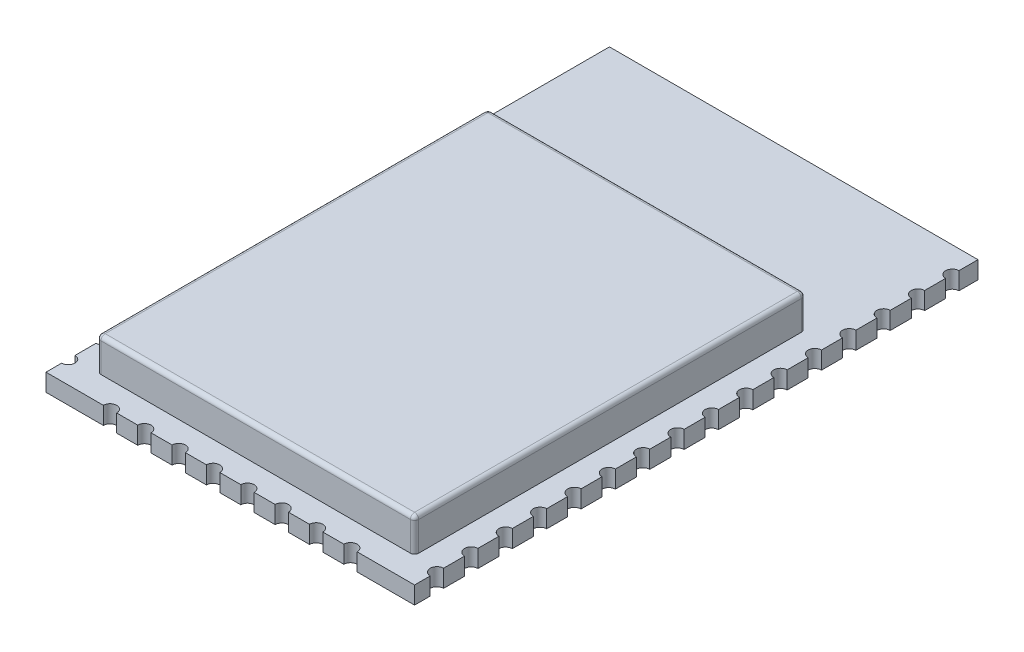
from build123d import *

# Parameters (mm, degrees)
ESQUISSE1_W             = 22.098
ESQUISSE1_H             = 33.782
BOSS_EXTRU_1_DEPTH      = 1.048
ESQUISSE2_W             = 19.05
ESQUISSE2_H             = 23.442994478
BOSS_EXTRU_2_DEPTH      = 2
ENL_V_MAT_EXTRU_1_DEPTH = 2
CONG_1_R                = 0.25


with BuildPart() as part:
    # Esquisse1 → Boss.-Extru.1 (new body)
    with BuildSketch(Plane(origin=(0, 0, 0), x_dir=(1, 0, 0), z_dir=(0, 1, 0))):
        with Locations((11.049, 16.891)):
            Rectangle(ESQUISSE1_W, ESQUISSE1_H)
    extrude(amount=BOSS_EXTRU_1_DEPTH)

    # Esquisse2 → Boss.-Extru.2 (add)
    with BuildSketch(Plane(origin=(0, 1.048, 0), x_dir=(1, 0, 0), z_dir=(0, 1, 0))):
        with Locations((11.049, 13.245497239)):
            Rectangle(ESQUISSE2_W, ESQUISSE2_H)
    extrude(amount=BOSS_EXTRU_2_DEPTH)

    # Esquisse3 → Enlèv. mat.-Extru.1 (cut)
    with BuildSketch(Plane(origin=(0, 1.048, 0), x_dir=(1, 0, 0), z_dir=(0, 1, 0))):
        with BuildLine():
            Line((0, 26.4604), (0, 25.6604))
            ThreePointArc((0, 25.6604), (0.4, 26.0604), (0, 26.4604))
        make_face()
        with BuildLine():
            Line((22.098, 26.4604), (22.098, 25.6604))
            ThreePointArc((22.098, 25.6604), (21.698, 26.0604), (22.098, 26.4604))
        make_face()
        with BuildLine():
            Line((22.098, 24.4004), (22.098, 23.6004))
            ThreePointArc((22.098, 23.6004), (21.698, 24.0004), (22.098, 24.4004))
        make_face()
        with BuildLine():
            Line((0, 24.4004), (0, 23.6004))
            ThreePointArc((0, 23.6004), (0.4, 24.0004), (0, 24.4004))
        make_face()
        with BuildLine():
            Line((22.098, 22.3404), (22.098, 21.5404))
            ThreePointArc((22.098, 21.5404), (21.698, 21.9404), (22.098, 22.3404))
        make_face()
        with BuildLine():
            Line((0, 22.3404), (0, 21.5404))
            ThreePointArc((0, 21.5404), (0.4, 21.9404), (0, 22.3404))
        make_face()
        with BuildLine():
            Line((22.098, 20.2804), (22.098, 19.4804))
            ThreePointArc((22.098, 19.4804), (21.698, 19.8804), (22.098, 20.2804))
        make_face()
        with BuildLine():
            Line((0, 20.2804), (0, 19.4804))
            ThreePointArc((0, 19.4804), (0.4, 19.8804), (0, 20.2804))
        make_face()
        with BuildLine():
            Line((22.098, 18.2204), (22.098, 17.4204))
            ThreePointArc((22.098, 17.4204), (21.698, 17.8204), (22.098, 18.2204))
        make_face()
        with BuildLine():
            Line((0, 18.2204), (0, 17.4204))
            ThreePointArc((0, 17.4204), (0.4, 17.8204), (0, 18.2204))
        make_face()
        with BuildLine():
            Line((22.098, 16.1604), (22.098, 15.3604))
            ThreePointArc((22.098, 15.3604), (21.698, 15.7604), (22.098, 16.1604))
        make_face()
        with BuildLine():
            Line((0, 16.1604), (0, 15.3604))
            ThreePointArc((0, 15.3604), (0.4, 15.7604), (0, 16.1604))
        make_face()
        with BuildLine():
            Line((22.098, 14.1004), (22.098, 13.3004))
            ThreePointArc((22.098, 13.3004), (21.698, 13.7004), (22.098, 14.1004))
        make_face()
        with BuildLine():
            Line((0, 14.1004), (0, 13.3004))
            ThreePointArc((0, 13.3004), (0.4, 13.7004), (0, 14.1004))
        make_face()
        with BuildLine():
            Line((22.098, 12.0404), (22.098, 11.2404))
            ThreePointArc((22.098, 11.2404), (21.698, 11.6404), (22.098, 12.0404))
        make_face()
        with BuildLine():
            Line((0, 12.0404), (0, 11.2404))
            ThreePointArc((0, 11.2404), (0.4, 11.6404), (0, 12.0404))
        make_face()
        with BuildLine():
            Line((22.098, 9.9804), (22.098, 9.1804))
            ThreePointArc((22.098, 9.1804), (21.698, 9.5804), (22.098, 9.9804))
        make_face()
        with BuildLine():
            Line((0, 9.9804), (0, 9.1804))
            ThreePointArc((0, 9.1804), (0.4, 9.5804), (0, 9.9804))
        make_face()
        with BuildLine():
            Line((22.098, 7.9204), (22.098, 7.1204))
            ThreePointArc((22.098, 7.1204), (21.698, 7.5204), (22.098, 7.9204))
        make_face()
        with BuildLine():
            Line((0, 7.9204), (0, 7.1204))
            ThreePointArc((0, 7.1204), (0.4, 7.5204), (0, 7.9204))
        make_face()
        with BuildLine():
            Line((22.098, 5.8604), (22.098, 5.0604))
            ThreePointArc((22.098, 5.0604), (21.698, 5.4604), (22.098, 5.8604))
        make_face()
        with BuildLine():
            Line((0, 5.8604), (0, 5.0604))
            ThreePointArc((0, 5.0604), (0.4, 5.4604), (0, 5.8604))
        make_face()
        with BuildLine():
            Line((22.098, 3.8004), (22.098, 3.0004))
            ThreePointArc((22.098, 3.0004), (21.698, 3.4004), (22.098, 3.8004))
        make_face()
        with BuildLine():
            Line((0, 3.8004), (0, 3.0004))
            ThreePointArc((0, 3.0004), (0.4, 3.4004), (0, 3.8004))
        make_face()
        with BuildLine():
            Line((22.098, 1.7404), (22.098, 0.9404))
            ThreePointArc((22.098, 0.9404), (21.698, 1.3404), (22.098, 1.7404))
        make_face()
        with BuildLine():
            Line((0, 1.7404), (0, 0.9404))
            ThreePointArc((0, 0.9404), (0.4, 1.3404), (0, 1.7404))
        make_face()
        with BuildLine():
            Line((22.098, 28.5204), (22.098, 27.7204))
            ThreePointArc((22.098, 27.7204), (21.698, 28.1204), (22.098, 28.5204))
        make_face()
        with BuildLine():
            Line((22.098, 30.5804), (22.098, 29.7804))
            ThreePointArc((22.098, 29.7804), (21.698, 30.1804), (22.098, 30.5804))
        make_face()
        with BuildLine():
            Line((22.098, 32.6404), (22.098, 31.8404))
            ThreePointArc((22.098, 31.8404), (21.698, 32.2404), (22.098, 32.6404))
        make_face()
        with BuildLine():
            Line((10.419, 0), (9.619, 0))
            ThreePointArc((9.619, 0), (10.019, 0.4), (10.419, 0))
        make_face()
        with BuildLine():
            Line((12.479, 0), (11.679, 0))
            ThreePointArc((11.679, 0), (12.079, 0.4), (12.479, 0))
        make_face()
        with BuildLine():
            Line((14.539, 0), (13.739, 0))
            ThreePointArc((13.739, 0), (14.139, 0.4), (14.539, 0))
        make_face()
        with BuildLine():
            Line((16.599, 0), (15.799, 0))
            ThreePointArc((15.799, 0), (16.199, 0.4), (16.599, 0))
        make_face()
        with BuildLine():
            Line((18.659, 0), (17.859, 0))
            ThreePointArc((17.859, 0), (18.259, 0.4), (18.659, 0))
        make_face()
        with BuildLine():
            Line((8.359, 0), (7.559, 0))
            ThreePointArc((7.559, 0), (7.959, 0.4), (8.359, 0))
        make_face()
        with BuildLine():
            Line((6.299, 0), (5.499, 0))
            ThreePointArc((5.499, 0), (5.899, 0.4), (6.299, 0))
        make_face()
        with BuildLine():
            Line((4.239, 0), (3.439, 0))
            ThreePointArc((3.439, 0), (3.839, 0.4), (4.239, 0))
        make_face()
    extrude(amount=-ENL_V_MAT_EXTRU_1_DEPTH, mode=Mode.SUBTRACT)

    # Congé1
    cong_1_edges = [part.edges().sort_by_distance(p)[0] for p in [
        (1.524, 2.048, -24.966994478),
        (1.524, 2.048, -1.524),
        (20.574, 2.048, -1.524),
        (20.574, 2.048, -24.966994478),
        (1.524, 3.048, -13.245497239),
        (11.049, 3.048, -1.524),
        (20.574, 3.048, -13.245497239),
        (11.049, 3.048, -24.966994478),
    ]]
    fillet(cong_1_edges, radius=CONG_1_R)


solid = part.part
